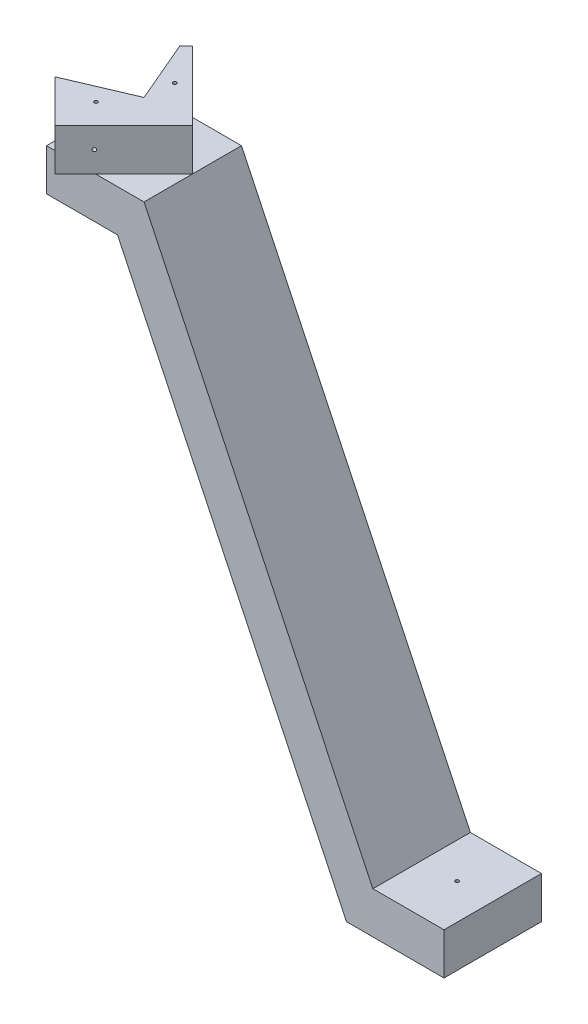
from build123d import *

# Parameters (mm, degrees)
BOSS_EXTRUDE1_DEPTH          = 44.45
F_1_8_0_125_DIAMETER_HOLE1_D = 3.175
BOSS_EXTRUDE2_DEPTH          = 38.1
CUT_EXTRUDE1_DEPTH           = 541.666761283
CUT_EXTRUDE1_DEPTH_BACK      = 541.666761283
F_1_8_0_125_DIAMETER_HOLE2_D = 3.175
F_1_8_0_125_DIAMETER_HOLE3_D = 3.175
F_1_8_0_125_DIAMETER_HOLE4_D = 3.175


with BuildPart() as part:
    # Sketch1 → Boss-Extrude1 (new, symmetric)
    with BuildSketch(Plane.XY):
        Polygon((0, 0), (-208.79812848, 438.15), (-273.64947152, 438.15), (-273.64947152, 476.25), (-184.74947152, 476.25), (24.04865696, 38.1), (88.9, 38.1), (88.9, 0), align=None)
    extrude(amount=BOSS_EXTRUDE1_DEPTH, both=True)

    # 1/8 (0.125) Diameter Hole1 (through all)
    with Locations(Plane(origin=(56.47432848, 38.1, 0), x_dir=(0, 0, 1), z_dir=(0, 1, 0))):
        with Locations((0, 0)):
            Hole(F_1_8_0_125_DIAMETER_HOLE1_D / 2)

    # Sketch4 → Boss-Extrude2 (add)
    with BuildSketch(Plane(origin=(0, 476.25, 0), x_dir=(1, 0, 0), z_dir=(0, 1, 0))):
        Polygon((-247.611264367, 62.861792847), (-184.74947152, 0), (-247.611264367, -62.861792847), (-310.473057215, 0), align=None)
    extrude(amount=BOSS_EXTRUDE2_DEPTH)

    # Sketch6 → Cut-Extrude1 (cut, two sides: drawn at the far end of the back side and taken through both)
    with BuildSketch(Plane.XZ.offset(-438.15).offset(-CUT_EXTRUDE1_DEPTH_BACK)):
        Polygon((-310.473057215, 34.697981215), (-229.19947152, 0), (-310.473057215, -190.368300991), align=None)
    extrude(amount=CUT_EXTRUDE1_DEPTH + CUT_EXTRUDE1_DEPTH_BACK, mode=Mode.SUBTRACT)

    # 1/8 (0.125) Diameter Hole2 (through all)
    with Locations(Plane(origin=(-92.37473576, 0, -92.37473576), x_dir=(0.707106781186549, 0, -0.707106781186546), z_dir=(0.707106781186546, 0, 0.707106781186549))):
        with Locations((-194.137604132, 495.3)):
            Hole(F_1_8_0_125_DIAMETER_HOLE2_D / 2)

    # 1/8 (0.125) Diameter Hole3 (through all)
    with Locations(Plane(origin=(-92.37473576, 0, 92.37473576), x_dir=(-0.707106781186549, 0, -0.707106781186546), z_dir=(0.707106781186546, 0, -0.707106781186549))):
        with Locations((194.137604132, 495.3)):
            Hole(F_1_8_0_125_DIAMETER_HOLE3_D / 2)

    # 1/8 (0.125) Diameter Hole4 (through all)
    with Locations(Plane(origin=(0, 438.15, 0), x_dir=(-1, 0, 0), z_dir=(0, -1, 0))):
        with Locations((247.611264367, -25.4), (226.57812848, 25.4)):
            Hole(F_1_8_0_125_DIAMETER_HOLE4_D / 2)


solid = part.part
